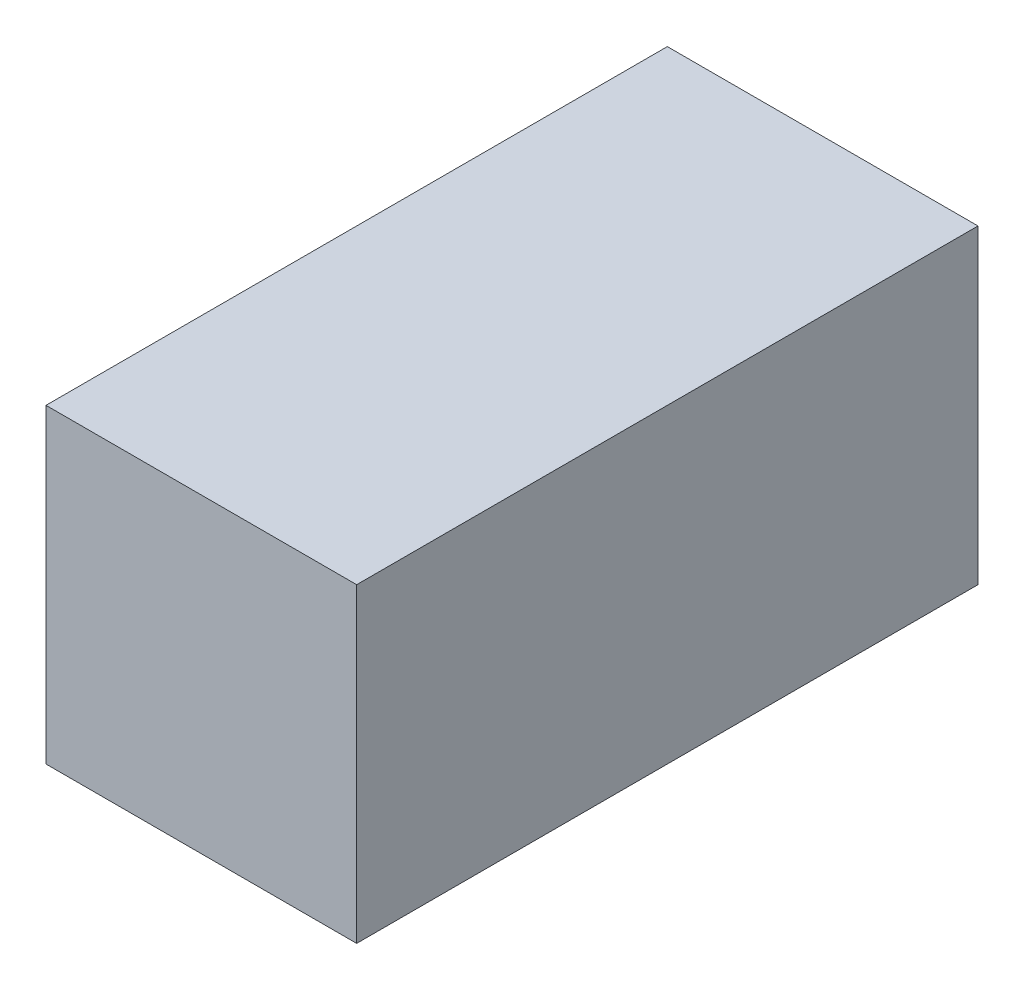
from build123d import *

# Parameters (mm, degrees)
SKETCH1_W           = 35
SKETCH1_H           = 35
BOSS_EXTRUDE1_DEPTH = 70


with BuildPart() as part:
    # Sketch1 → Boss-Extrude1 (new body)
    with BuildSketch(Plane.XY):
        Rectangle(SKETCH1_W, SKETCH1_H)
    extrude(amount=BOSS_EXTRUDE1_DEPTH)


solid = part.part
